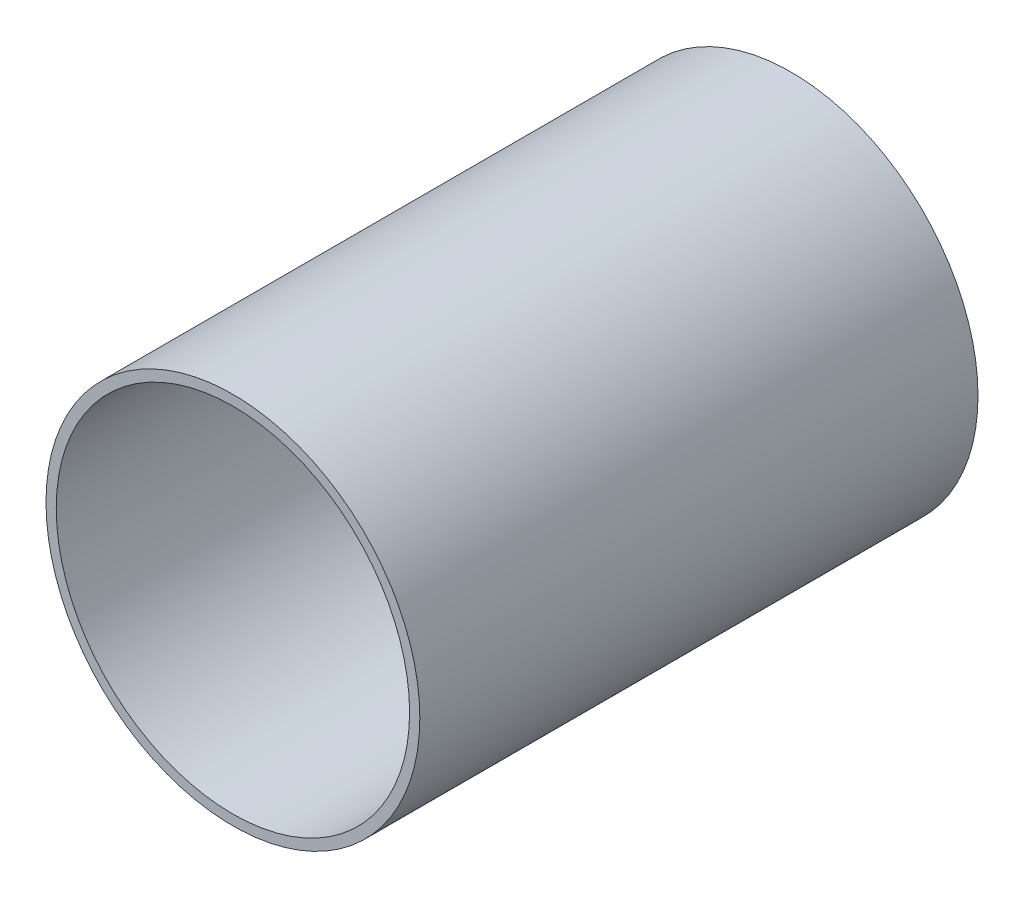
from build123d import *

# Parameters (mm, degrees)
ESQUISSE1_R        = 36.5
BOSS_EXTRU_1_DEPTH = 109
COQUE1_T           = -2


with BuildPart() as part:
    # Esquisse1 → Boss.-Extru.1 (new body)
    with BuildSketch(Plane.XY):
        Circle(ESQUISSE1_R)
    extrude(amount=BOSS_EXTRU_1_DEPTH)

    # Coque1
    coque1_openings = [part.faces().sort_by_distance(p)[0] for p in [
        (0, 0, 109),
    ]]
    offset(amount=COQUE1_T, openings=coque1_openings, kind=Kind.INTERSECTION)


solid = part.part
